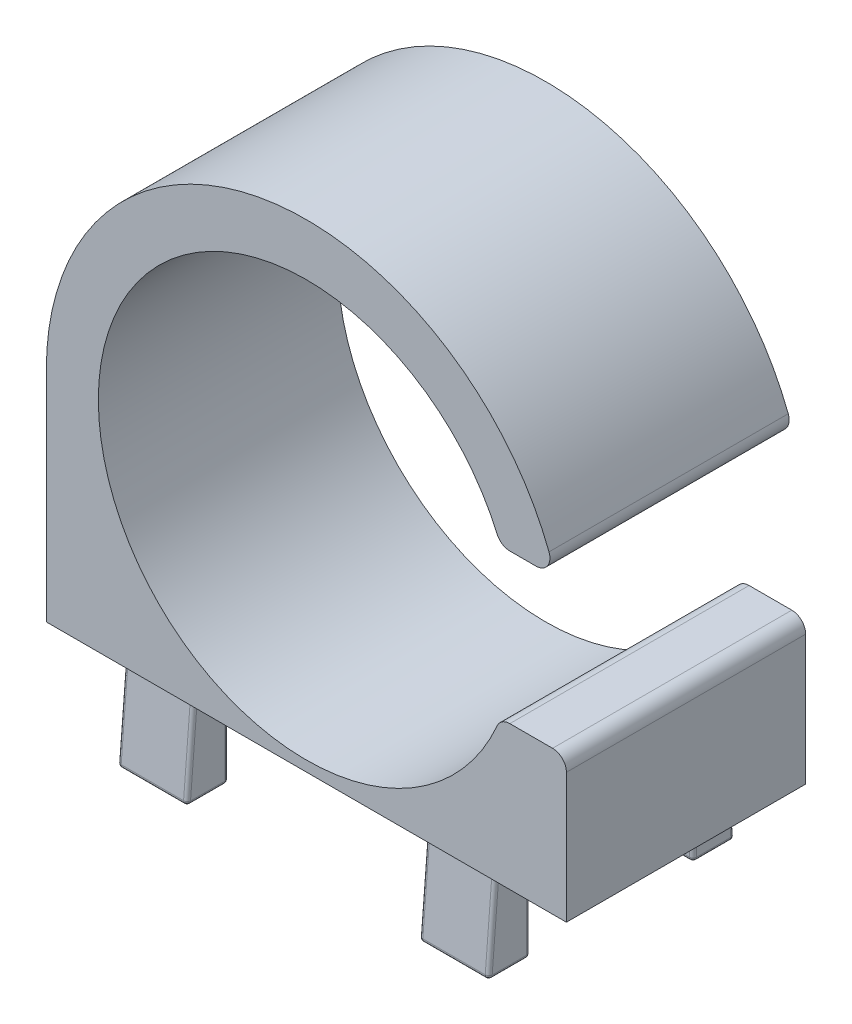
from build123d import *

# Parameters (mm, degrees)
SKETCH1_R               = 15.24
BOSS_EXTRUDE1_DEPTH     = 17.526
CUT_EXTRUDE2_DEPTH      = 33.139783384
BOSS_EXTRUDE2_DEPTH     = 38.1
CUT_EXTRUDE1_DEPTH      = 35.33136764
CUT_EXTRUDE1_DEPTH_BACK = 35.33136764
SKETCH4_W               = 17.018
SKETCH4_H               = 6.35
SKETCH4_W_2             = 5.461
FILLET1_R               = 0.254
FILLET2_R               = 1.016


with BuildPart() as part:
    # Sketch1 → Boss-Extrude1 (new body)
    with BuildSketch(Plane.XY):
        with BuildLine():
            Line((-19.05, 0), (-19.05, -16.002))
            Line((-19.05, -16.002), (19.05, -16.002))
            Line((19.05, -16.002), (19.05, 0))
            ThreePointArc((19.05, 0), (0, 19.05), (-19.05, 0))
        make_face()
        Circle(SKETCH1_R, mode=Mode.SUBTRACT)
    extrude(amount=BOSS_EXTRUDE1_DEPTH)

    # Sketch5 → Cut-Extrude2 (cut, through all)
    with BuildSketch(Plane.XY.offset(17.526)):
        with BuildLine():
            Line((19.05, -5.474194202), (19.05, 0))
            ThreePointArc((19.05, 0), (18.848061086, 2.766422474), (18.246525637, 5.474194202))
            Line((18.246525637, 5.474194202), (14.222896957, 5.474194202))
            ThreePointArc((14.222896957, 5.474194202), (15.24, 0), (14.222896957, -5.474194202))
            Line((14.222896957, -5.474194202), (19.05, -5.474194202))
        make_face()
    extrude(amount=-CUT_EXTRUDE2_DEPTH, mode=Mode.SUBTRACT)

    # Sketch3 → Boss-Extrude2 (add)
    with BuildSketch(Plane(origin=(19.05, 0, 0), x_dir=(0, 0, -1), z_dir=(1, 0, 0))):
        Polygon((-2.794, -16.002), (-2.794, -22.352), (0.254, -22.352), (-0.254, -16.002), align=None)
        Polygon((-14.732, -16.002), (-14.732, -22.352), (-17.78, -22.352), (-17.272, -16.002), align=None)
    extrude(amount=-BOSS_EXTRUDE2_DEPTH)

    # Sketch4 → Cut-Extrude1 (cut, two sides: drawn at the far end of the back side and taken through both)
    with BuildSketch(Plane(origin=(0, 0, 0), x_dir=(-1, 0, 0), z_dir=(0, 0, -1)).offset(-CUT_EXTRUDE1_DEPTH_BACK)):
        with Locations((0, -19.177)):
            Rectangle(SKETCH4_W, SKETCH4_H)
        with Locations((16.3195, -19.177)):
            Rectangle(SKETCH4_W_2, SKETCH4_H)
        with Locations((-16.3195, -19.177)):
            Rectangle(SKETCH4_W_2, SKETCH4_H)
    extrude(amount=CUT_EXTRUDE1_DEPTH + CUT_EXTRUDE1_DEPTH_BACK, mode=Mode.SUBTRACT)

    # Fillet1
    fillet1_edges = [part.edges().sort_by_distance(p)[0] for p in [
        (13.589, -19.177, 14.732),
        (13.589, -22.352, 1.27),
        (13.589, -22.352, 16.256),
        (-13.589, -19.177, 0),
        (-13.589, -19.177, 2.794),
        (-13.589, -19.177, 14.732),
        (-13.589, -22.352, 1.27),
        (-13.589, -22.352, 16.256),
        (8.509, -19.177, 0),
        (8.509, -19.177, 2.794),
        (8.509, -19.177, 14.732),
        (8.509, -22.352, 1.27),
        (-8.509, -19.177, 0),
        (-8.509, -19.177, 2.794),
        (-8.509, -19.177, 14.732),
        (-8.509, -22.352, 1.27),
        (8.509, -22.352, 16.256),
        (-8.509, -22.352, 16.256),
        (-11.049, -22.352, 17.78),
        (11.049, -22.352, 17.78),
        (-8.509, -19.177, 17.526),
        (8.509, -19.177, 17.526),
        (-13.589, -19.177, 17.526),
        (13.589, -19.177, 17.526),
        (-11.049, -22.352, 14.732),
        (11.049, -22.352, 14.732),
        (-11.049, -22.352, 2.794),
        (11.049, -22.352, 2.794),
        (-11.049, -22.352, -0.254),
        (11.049, -22.352, -0.254),
        (13.589, -19.177, 0),
        (13.589, -19.177, 2.794),
    ]]
    fillet(fillet1_edges, radius=FILLET1_R)

    # Fillet2
    fillet2_edges = [part.edges().sort_by_distance(p)[0] for p in [
        (18.246525637, 5.474194202, 8.763),
        (19.05, -5.474194202, 8.763),
        (14.222896957, -5.474194202, 8.763),
        (14.222896957, 5.474194202, 8.763),
    ]]
    fillet(fillet2_edges, radius=FILLET2_R)


solid = part.part
